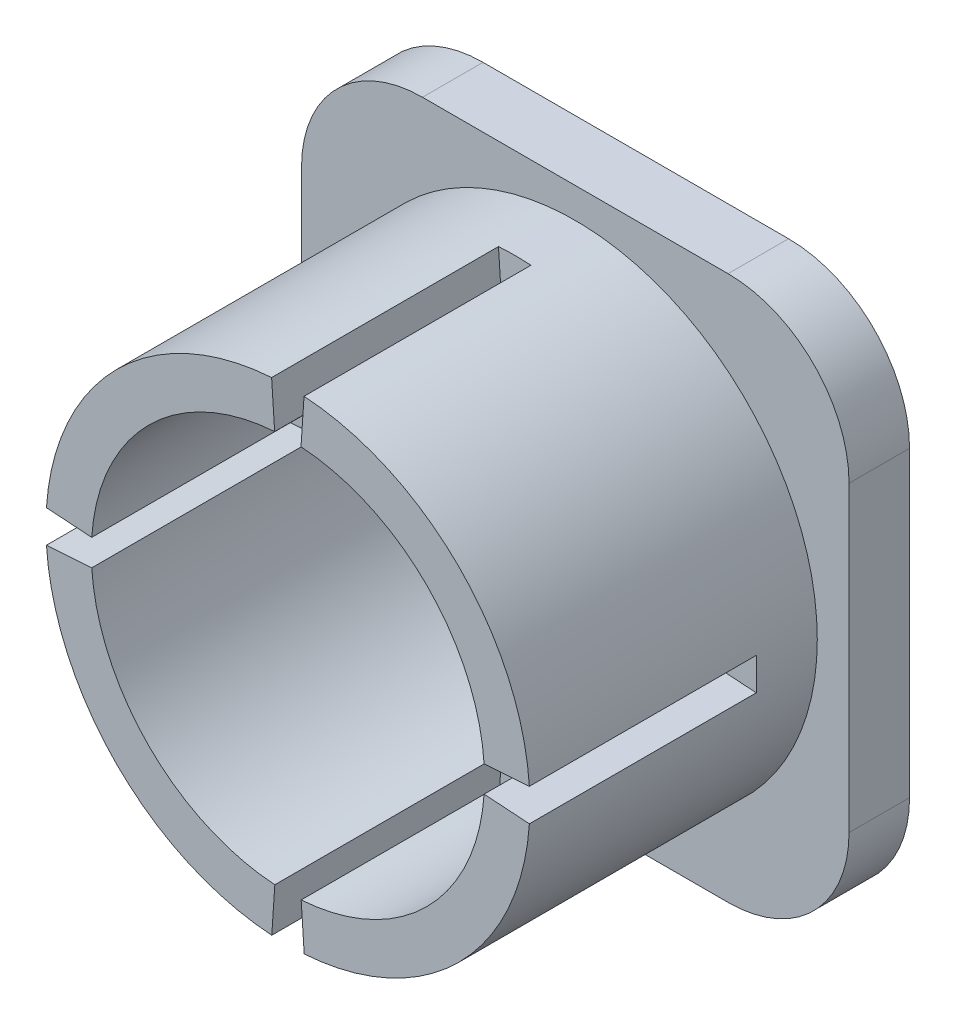
from build123d import *

# Parameters (mm, degrees)
BOSS_EXTRUDE1_DEPTH = 0.0001
BOSS_EXTRUDE2_DEPTH = 2
BOSS_EXTRUDE3_DEPTH = 0.0001
SKETCH4_R           = 8
BOSS_EXTRUDE4_DEPTH = 9.5
SKETCH5_R           = 6.5
CUT_EXTRUDE1_DEPTH  = 25
CUT_EXTRUDE4_DEPTH  = 7.5
CIRPATTERN2_COUNT   = 4


with BuildPart() as part:
    # Sketch1 → Boss-Extrude1 (new body)
    with BuildSketch(Plane.XY):
        with BuildLine():
            Line((-5.05, 9.000108401), (5.05, 9.000108401))
            ThreePointArc((5.05, 9.000108401), (7.878427125, 7.828535526), (9.05, 5.000108401))
            Line((9.05, 5.000108401), (9.05, -5.000108401))
            ThreePointArc((9.05, -5.000108401), (7.878427125, -7.828535526), (5.05, -9.000108401))
            Line((5.05, -9.000108401), (-5.05, -9.000108401))
            ThreePointArc((-5.05, -9.000108401), (-7.878427125, -7.828535526), (-9.05, -5.000108401))
            Line((-9.05, -5.000108401), (-9.05, 5.000108401))
            ThreePointArc((-9.05, 5.000108401), (-7.878427125, 7.828535526), (-5.05, 9.000108401))
        make_face()
    extrude(amount=BOSS_EXTRUDE1_DEPTH)

    # Sketch2 → Boss-Extrude2 (add)
    with BuildSketch(Plane.XY):
        with BuildLine():
            Line((-5.05, 9.000108401), (5.05, 9.000108401))
            ThreePointArc((5.05, 9.000108401), (7.878427125, 7.828535526), (9.05, 5.000108401))
            Line((9.05, 5.000108401), (9.05, -5.000108401))
            ThreePointArc((9.05, -5.000108401), (7.878427125, -7.828535526), (5.05, -9.000108401))
            Line((5.05, -9.000108401), (-5.05, -9.000108401))
            ThreePointArc((-5.05, -9.000108401), (-7.878427125, -7.828535526), (-9.05, -5.000108401))
            Line((-9.05, -5.000108401), (-9.05, 5.000108401))
            ThreePointArc((-9.05, 5.000108401), (-7.878427125, 7.828535526), (-5.05, 9.000108401))
        make_face()
    extrude(amount=BOSS_EXTRUDE2_DEPTH)

    # Sketch3 → Boss-Extrude3 (add)
    with BuildSketch(Plane.XY.offset(2)):
        with BuildLine():
            Line((-5.05, 9.000108401), (5.05, 9.000108401))
            ThreePointArc((5.05, 9.000108401), (7.878427125, 7.828535526), (9.05, 5.000108401))
            Line((9.05, 5.000108401), (9.05, -5.000108401))
            ThreePointArc((9.05, -5.000108401), (7.878427125, -7.828535526), (5.05, -9.000108401))
            Line((5.05, -9.000108401), (-5.05, -9.000108401))
            ThreePointArc((-5.05, -9.000108401), (-7.878427125, -7.828535526), (-9.05, -5.000108401))
            Line((-9.05, -5.000108401), (-9.05, 5.000108401))
            ThreePointArc((-9.05, 5.000108401), (-7.878427125, 7.828535526), (-5.05, 9.000108401))
        make_face()
    extrude(amount=BOSS_EXTRUDE3_DEPTH)

    # Sketch4 → Boss-Extrude4 (add)
    with BuildSketch(Plane.XY.offset(2.0001)):
        Circle(SKETCH4_R)
    extrude(amount=BOSS_EXTRUDE4_DEPTH)

    # Sketch5 → Cut-Extrude1 (cut, symmetric)
    with BuildSketch(Plane.XY.offset(2.0001)):
        Circle(SKETCH5_R)
    extrude(amount=CUT_EXTRUDE1_DEPTH, both=True, mode=Mode.SUBTRACT)

    # Sketch15 → Cut-Extrude4 (cut)
    with BuildSketch(Plane.XY.offset(11.5001)):
        Polygon((-0.552830798, 8.187091014), (-0.002830798, 0.003314653), (0.547169202, 8.187091014), (0.617169202, 9.000108401), (-0.626042329, 9.000108401), align=None)
    cut_extrude4 = extrude(amount=-CUT_EXTRUDE4_DEPTH, mode=Mode.SUBTRACT)

    # CirPattern2: Cut-Extrude4 ×4 about axis
    cirpattern2_axis = Axis((0, 0, 0), (0, 0, 1))
    for i in range(1, CIRPATTERN2_COUNT):
        add(cut_extrude4.rotate(cirpattern2_axis, i * 360 / CIRPATTERN2_COUNT), mode=Mode.SUBTRACT)


solid = part.part
